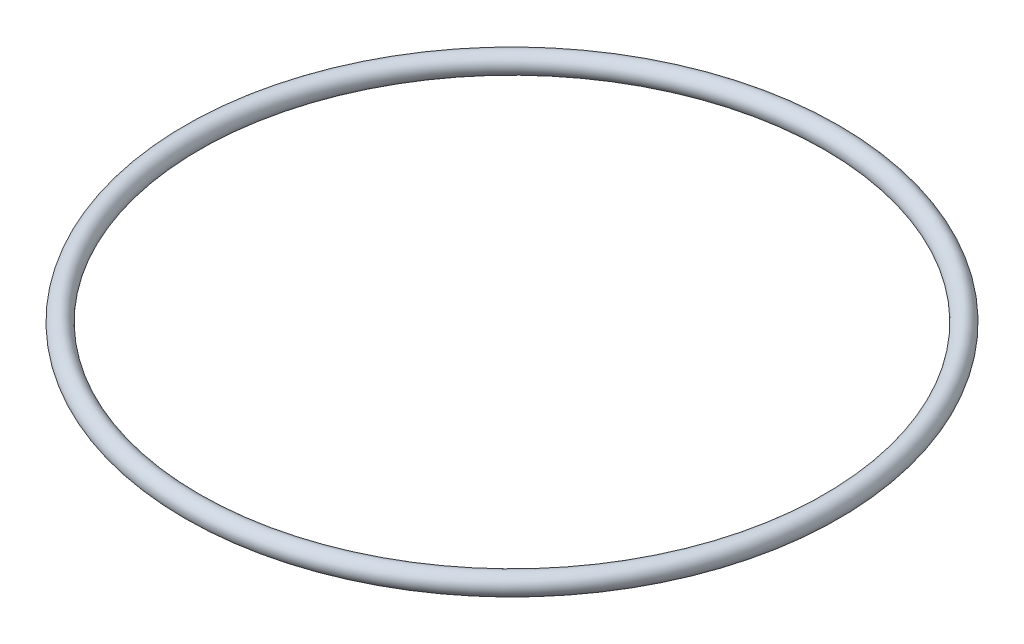
from build123d import *

# Parameters (mm, degrees)
CROQUIS1_R = 12.5


with BuildPart() as part:
    # Croquis1 → Revolución1 (revolve)
    with BuildSketch(Plane.XY, mode=Mode.PRIVATE) as revoluci_n1_sk:
        with Locations((400, 0)):
            Circle(CROQUIS1_R)
    revolve(revoluci_n1_sk.sketch.rotate(Axis((0, 0, 0), (0, 1, 0)), 90), axis=Axis((0, 0, 0), (0, 1, 0)))


solid = part.part
